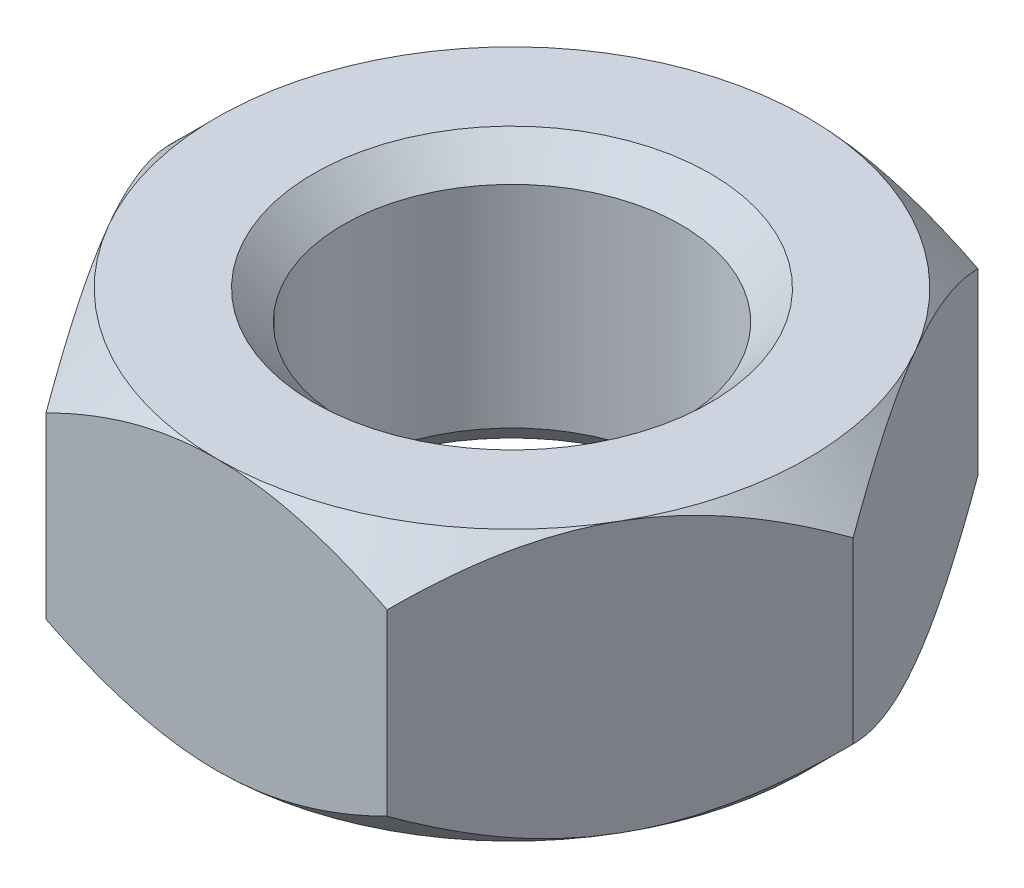
from build123d import *

# Parameters (mm, degrees)
SKETCH1_R           = 2
BOSS_EXTRUDE1_DEPTH = 3.2
CHAMFER1_SIZE       = 0.35


with BuildPart() as part:
    # Sketch1 → Boss-Extrude1 (new body)
    with BuildSketch(Plane(origin=(0, 0, 0), x_dir=(1, 0, 0), z_dir=(0, 1, 0))):
        Polygon((4.041451884, 0), (2.020725942, 3.5), (-2.020725942, 3.5), (-4.041451884, 0), (-2.020725942, -3.5), (2.020725942, -3.5), align=None)
        with Locations(Location((0, 0, 0), (0, 0, 270))):
            Circle(SKETCH1_R, mode=Mode.SUBTRACT)
    extrude(amount=BOSS_EXTRUDE1_DEPTH)

    # Sketch3 → Cut-Revolve1 (revolve, cut)
    with BuildSketch(Plane(origin=(0, 0, 0), x_dir=(0, 0, -1), z_dir=(1, 0, 0))):
        Polygon((-3.5, 0), (-4.041451884, 0.541451884), (-4.041451884, 0), align=None)
        Polygon((-4.041451884, 3.2), (-3.5, 3.2), (-4.041451884, 2.658548116), align=None)
    revolve(axis=Axis((0, 0, 0), (0, 1, 0)), mode=Mode.SUBTRACT)

    # Chamfer1
    chamfer1_edges = [part.edges().sort_by_distance(p)[0] for p in [
        (0, 0, -2),
        (0, 3.2, -2),
    ]]
    chamfer(chamfer1_edges, length=CHAMFER1_SIZE)


solid = part.part
